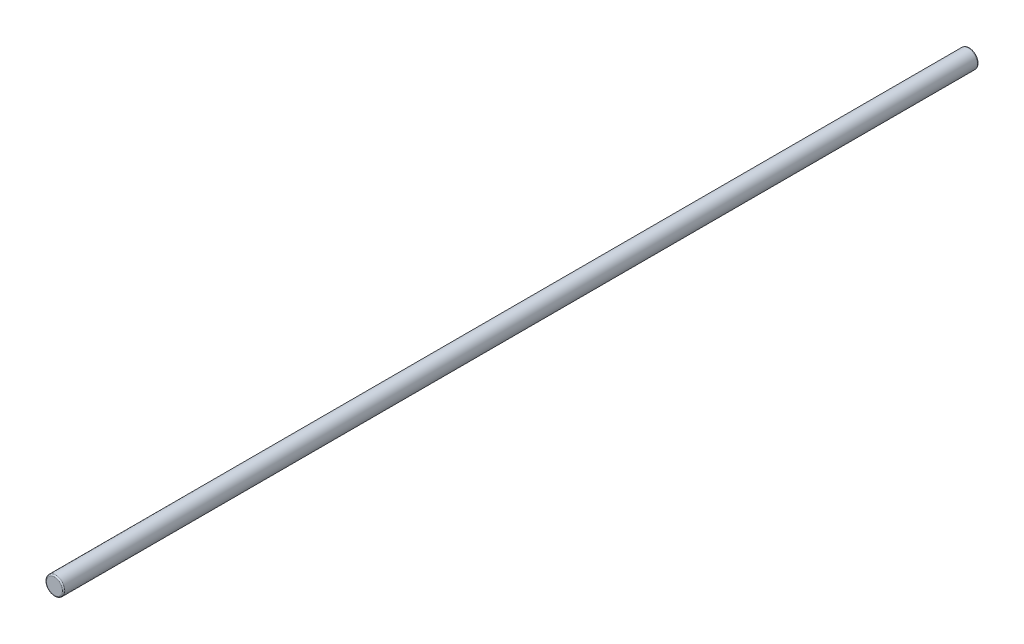
from build123d import *

# Parameters (mm, degrees)
CROQUIS1_R              = 1.5
SALIENTE_EXTRUIR1_DEPTH = 150
REDONDEO2_R             = 0.2
REDONDEO3_R             = 0.2


with BuildPart() as part:
    # Croquis1 → Saliente-Extruir1 (new body)
    with BuildSketch(Plane.XY):
        Circle(CROQUIS1_R)
    extrude(amount=SALIENTE_EXTRUIR1_DEPTH)

    # Redondeo2
    redondeo2_edges = [part.edges().sort_by_distance(p)[0] for p in [
        (-1.5, 0, 150),
    ]]
    fillet(redondeo2_edges, radius=REDONDEO2_R)

    # Redondeo3
    redondeo3_edges = [part.edges().sort_by_distance(p)[0] for p in [
        (-1.5, 0, 0),
    ]]
    fillet(redondeo3_edges, radius=REDONDEO3_R)


solid = part.part
